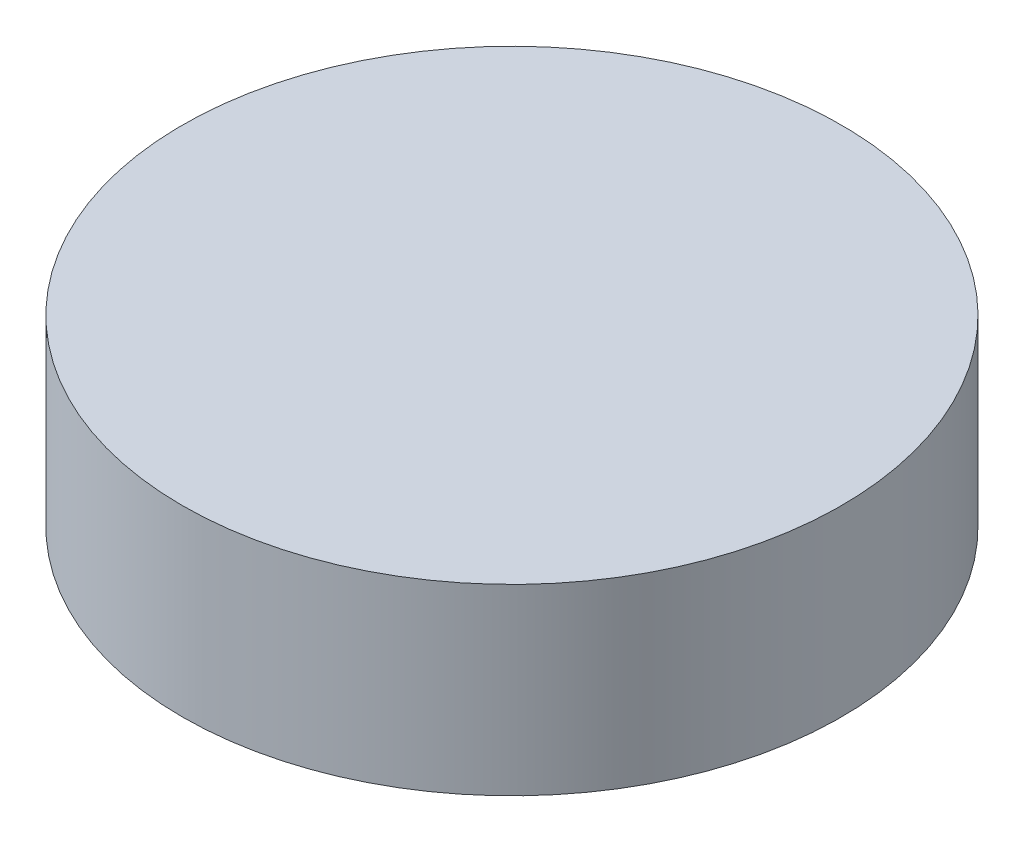
from build123d import *

# Parameters (mm, degrees)
SKETCH1_R           = 11.43
BOSS_EXTRUDE1_DEPTH = 6.35


with BuildPart() as part:
    # Sketch1 → Boss-Extrude1 (new body)
    with BuildSketch(Plane(origin=(0, 0, 0), x_dir=(1, 0, 0), z_dir=(0, 1, 0))):
        with Locations(Location((4.999655882, -4.961936119, 0), (0, 0, 270))):
            Circle(SKETCH1_R)
    extrude(amount=BOSS_EXTRUDE1_DEPTH)


solid = part.part
